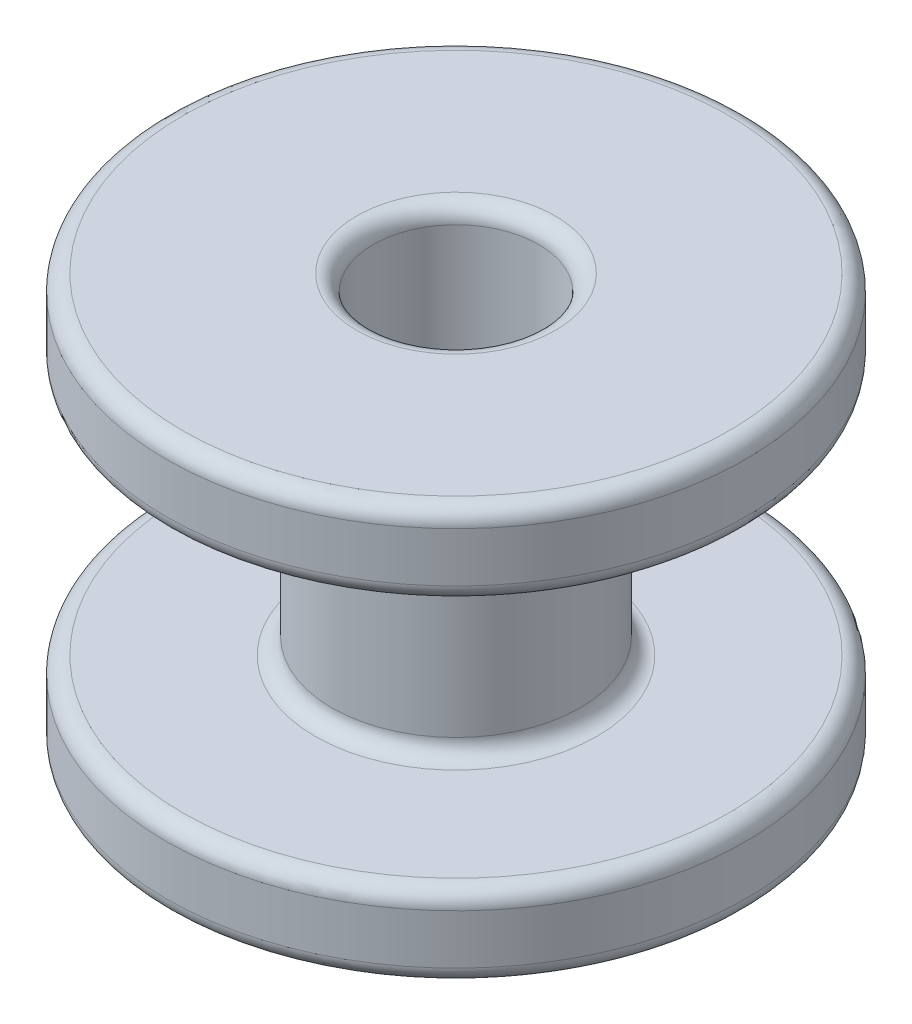
from build123d import *

# Parameters (mm, degrees)
SKETCH1_R           = 1.5
BOSS_EXTRUDE1_DEPTH = 1.5
SKETCH2_R           = 3.5
BOSS_EXTRUDE2_DEPTH = 1
SKETCH3_R           = 1
CUT_EXTRUDE1_DEPTH  = 6.545268253
FILLET1_R           = 0.2
FILLET2_R           = 0.2


with BuildPart() as part:
    # Sketch1 → Boss-Extrude1 (new body)
    with BuildSketch(Plane(origin=(0, 0, 0), x_dir=(1, 0, 0), z_dir=(0, 1, 0))):
        with Locations(Location((0, 0, 0), (0, 0, 270))):
            Circle(SKETCH1_R)
    extrude(amount=BOSS_EXTRUDE1_DEPTH)

    # Sketch2 → Boss-Extrude2 (add)
    with BuildSketch(Plane(origin=(0, 1.5, 0), x_dir=(1, 0, 0), z_dir=(0, 1, 0))):
        with Locations(Location((0, 0, 0), (0, 0, 270))):
            Circle(SKETCH2_R)
    extrude(amount=BOSS_EXTRUDE2_DEPTH)

    # Sketch3 → Cut-Extrude1 (cut, through all)
    with BuildSketch(Plane(origin=(0, 2.5, 0), x_dir=(1, 0, 0), z_dir=(0, 1, 0))):
        with Locations(Location((0, 0, 0), (0, 0, 270))):
            Circle(SKETCH3_R)
    extrude(amount=-CUT_EXTRUDE1_DEPTH, mode=Mode.SUBTRACT)

    # Fillet1
    fillet1_edges = [part.edges().sort_by_distance(p)[0] for p in [
        (0, 0, -1),
        (0, 2.5, -1),
        (0, 1.5, -3.5),
        (0, 2.5, -3.5),
    ]]
    fillet(fillet1_edges, radius=FILLET1_R)

    # Fillet2
    fillet2_edges = [part.edges().sort_by_distance(p)[0] for p in [
        (0, 1.5, -1.5),
    ]]
    fillet(fillet2_edges, radius=FILLET2_R)

    # Mirror1: part across plane


with BuildPart() as part_1:
    add(part.part)
    add(part.part.mirror(Plane.ZX))


solid = part_1.part
